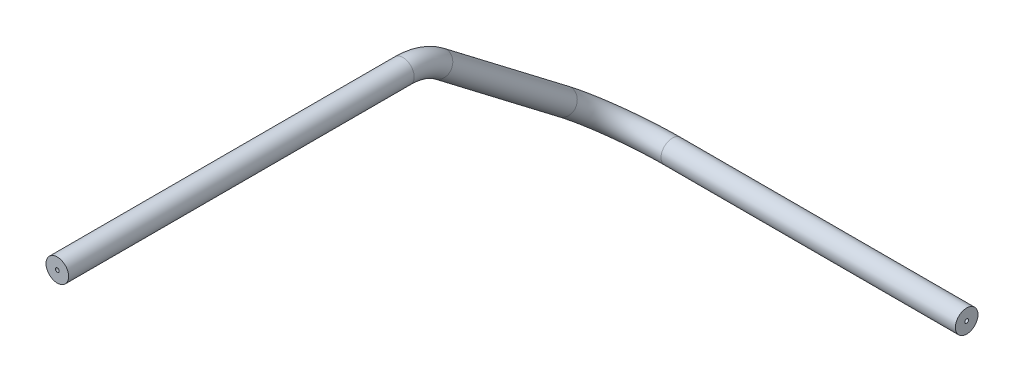
from build123d import *

# Parameters (mm, degrees)
SKICA4_R   = 3
SKICA4_R_2 = 0.5


with BuildPart() as part:
    # Táhnout po křivce1: sweep along a curve in space
    with BuildLine() as t_hnout_po_k_ivce1_path:
        Line((94, 0, 0), (16, 0, 0))
        ThreePointArc((16, 0, 0), (4.686291501, 2.845029331, 3.723860381), (0, 9.713537728, 12.714054617))
        Line((0, 9.713537728, 12.714054617), (0, 34.914054617, 45.699024368))
        ThreePointArc((0, 34.914054617, 45.699024368), (0, 37.35626725, 50.285422244), (0, 38.2, 55.412562096))
        Line((0, 38.2, 55.412562096), (0, 38.2, 147))
    # Skica4 → Táhnout po křivce1 (sweep)
    with BuildSketch(Plane(origin=(94, 0, 0), x_dir=(0, 0, -1), z_dir=(1, 0, 0))):
        Circle(SKICA4_R)
        Circle(SKICA4_R_2, mode=Mode.SUBTRACT)
    sweep(path=t_hnout_po_k_ivce1_path.line)


solid = part.part
